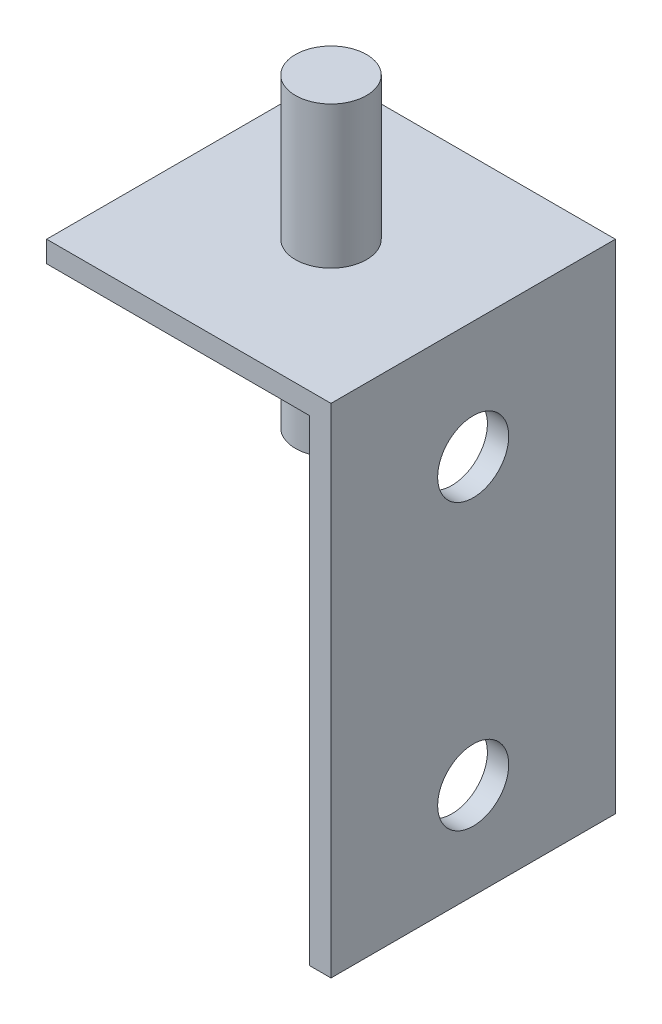
from build123d import *

# Parameters (mm, degrees)
SUPERFICIE_EXTRUIR1_1_DEPTH = 40
DAR_ESPESOR1_T1             = 3
EXTRUIR1_DEPTH              = 20
EXTRUIR1_DEPTH_BACK         = 23
CROQUIS2_R                  = 5
CROQUIS3_R                  = 5
EXTRUIR2_DEPTH              = 20


with BuildPart() as body_1:
    # Superficie-Extruir1: a surface, the sketch's curves swept straight by 40 mm
    with BuildLine(Plane.XY, mode=Mode.PRIVATE) as superficie_extruir1_1_path:
        Line((0, -70), (0, 0))
        Line((0, 0), (-40, 0))
    superficie_extruir1_1 = Shell.extrude(superficie_extruir1_1_path.wire(), (0 * SUPERFICIE_EXTRUIR1_1_DEPTH, 0 * SUPERFICIE_EXTRUIR1_1_DEPTH, 1 * SUPERFICIE_EXTRUIR1_1_DEPTH))
    add(Solid.thicken(superficie_extruir1_1, DAR_ESPESOR1_T1))

    # Croquis2 → Extruir1 (add, two sides: drawn at the far end of the back side and taken through both)
    with BuildSketch(Plane(origin=(0, 0, 0), x_dir=(1, 0, 0), z_dir=(0, 1, 0)).offset(-EXTRUIR1_DEPTH_BACK)):
        with Locations(Location((-20, -20, 0), (0, 0, 180))):
            Circle(CROQUIS2_R)
    extrude(amount=EXTRUIR1_DEPTH + EXTRUIR1_DEPTH_BACK)

    # Croquis3 → Extruir2 (cut)
    with BuildSketch(Plane.ZY.offset(3)):
        with Locations(Location((20, -56.5, 0), (0, 0, 270))):
            Circle(CROQUIS3_R)
        with Locations(Location((20, -16.5, 0), (0, 0, 90))):
            Circle(CROQUIS3_R)
    extrude(amount=-EXTRUIR2_DEPTH, mode=Mode.SUBTRACT)


solid = body_1.part
